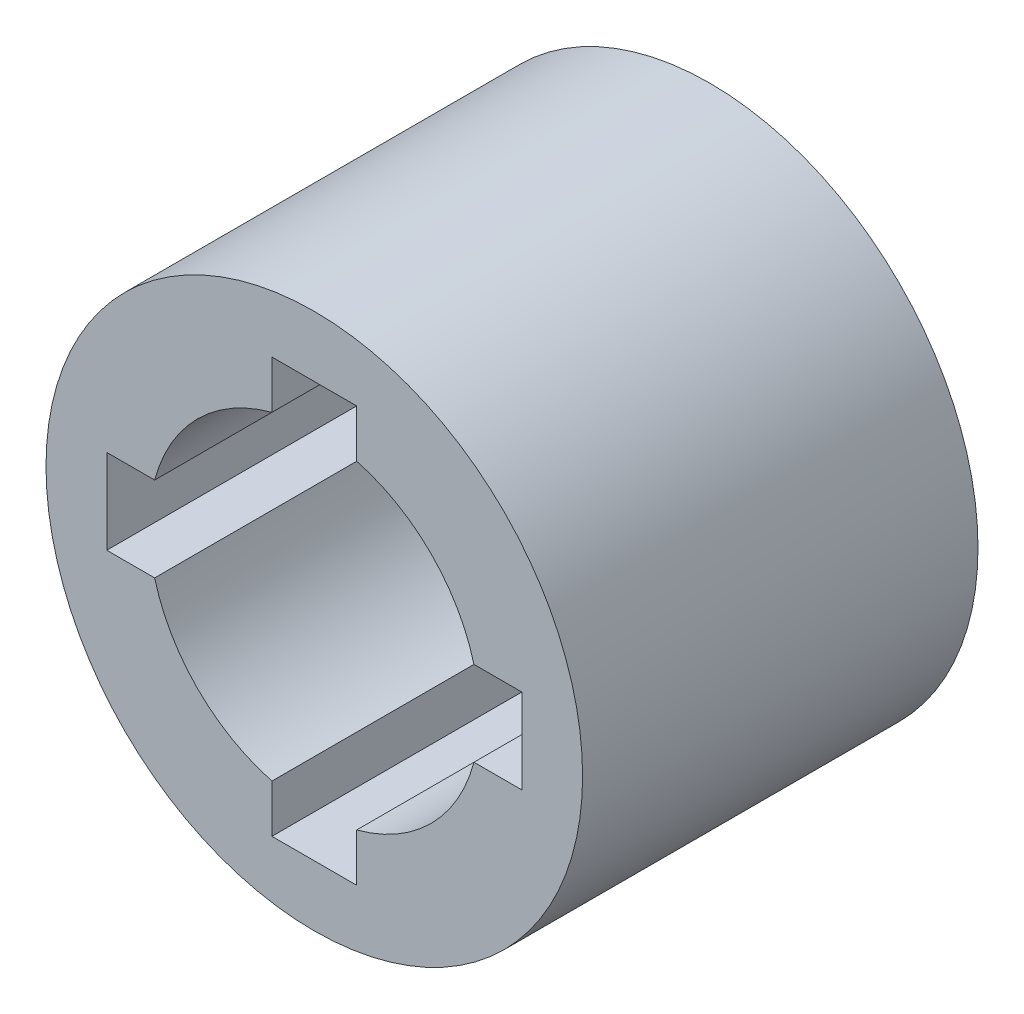
from build123d import *

# Parameters (mm, degrees)
SKETCH1_R           = 9.5
BOSS_EXTRUDE1_DEPTH = 14


with BuildPart() as part:
    # Sketch1 → Boss-Extrude1 (new body)
    with BuildSketch(Plane.XY):
        Circle(SKETCH1_R)
        with BuildLine():
            Line((-1.5, 5.652839314), (-1.5, 7.348469228))
            Line((-1.5, 7.348469228), (1.5, 7.348469228))
            Line((1.5, 7.348469228), (1.5, 5.652839314))
            ThreePointArc((1.5, 5.652839314), (4.135492251, 4.135492251), (5.652839314, 1.5))
            Line((5.652839314, 1.5), (7.348469228, 1.5))
            Line((7.348469228, 1.5), (7.348469228, -1.5))
            Line((7.348469228, -1.5), (5.652839314, -1.5))
            ThreePointArc((5.652839314, -1.5), (4.135492251, -4.135492251), (1.5, -5.652839314))
            Line((1.5, -5.652839314), (1.5, -7.348469228))
            Line((1.5, -7.348469228), (-1.5, -7.348469228))
            Line((-1.5, -7.348469228), (-1.5, -5.652839314))
            ThreePointArc((-1.5, -5.652839314), (-4.135492251, -4.135492251), (-5.652839314, -1.5))
            Line((-5.652839314, -1.5), (-7.348469228, -1.5))
            Line((-7.348469228, -1.5), (-7.348469228, 1.5))
            Line((-7.348469228, 1.5), (-5.652839314, 1.5))
            ThreePointArc((-5.652839314, 1.5), (-4.135492251, 4.135492251), (-1.5, 5.652839314))
        make_face(mode=Mode.SUBTRACT)
    extrude(amount=BOSS_EXTRUDE1_DEPTH)


solid = part.part
